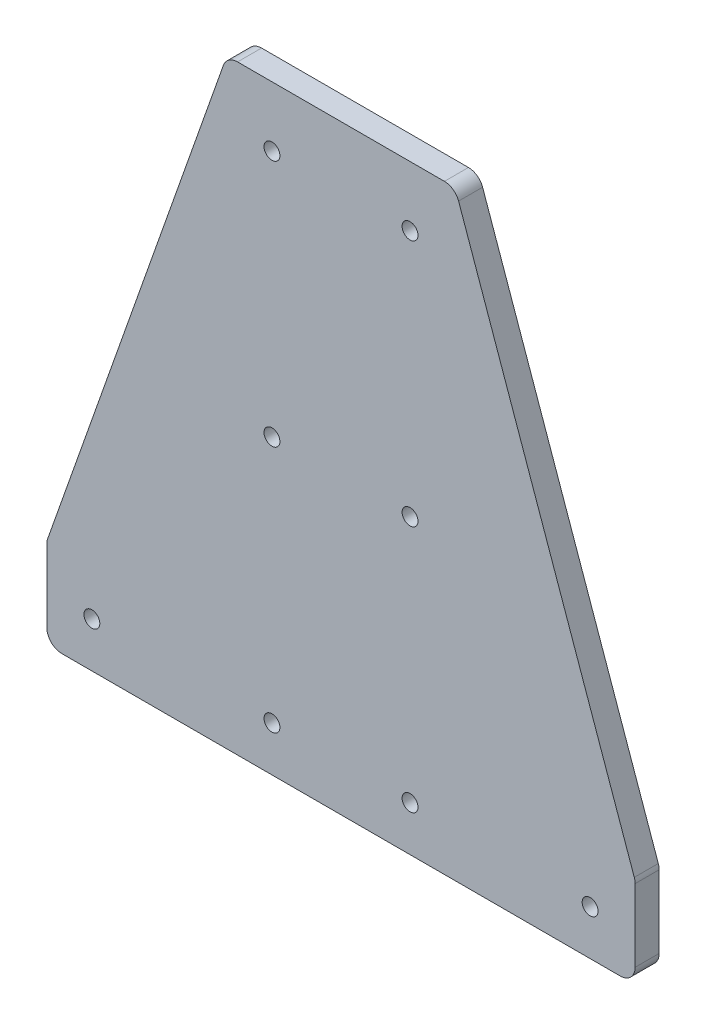
from build123d import *

# Parameters (mm, degrees)
BOSS_EXTRUDE1_DEPTH  = 8
M5_CLEARANCE_HOLE1_D = 5.3
FILLET1_R            = 5


with BuildPart() as part:
    # Sketch1 → Boss-Extrude1 (new body)
    with BuildSketch(Plane.XY):
        Polygon((-98, -30), (98, -30), (98, 0), (38, 170), (-38, 170), (-98, 0), align=None)
    extrude(amount=BOSS_EXTRUDE1_DEPTH)

    # M5 Clearance Hole1 (through all)
    with Locations(Plane.XY.offset(8)):
        with Locations((-23, 150), (-23, 67.5), (-23, -15), (23, -15), (23, 150), (23, 67.5), (-83, -15), (83, -15)):
            Hole(M5_CLEARANCE_HOLE1_D / 2)

    # Fillet1
    fillet1_edges = [part.edges().sort_by_distance(p)[0] for p in [
        (-98, 0, 4),
        (-38, 170, 4),
        (38, 170, 4),
        (98, 0, 4),
        (98, -30, 4),
        (-98, -30, 4),
    ]]
    fillet(fillet1_edges, radius=FILLET1_R)


solid = part.part
